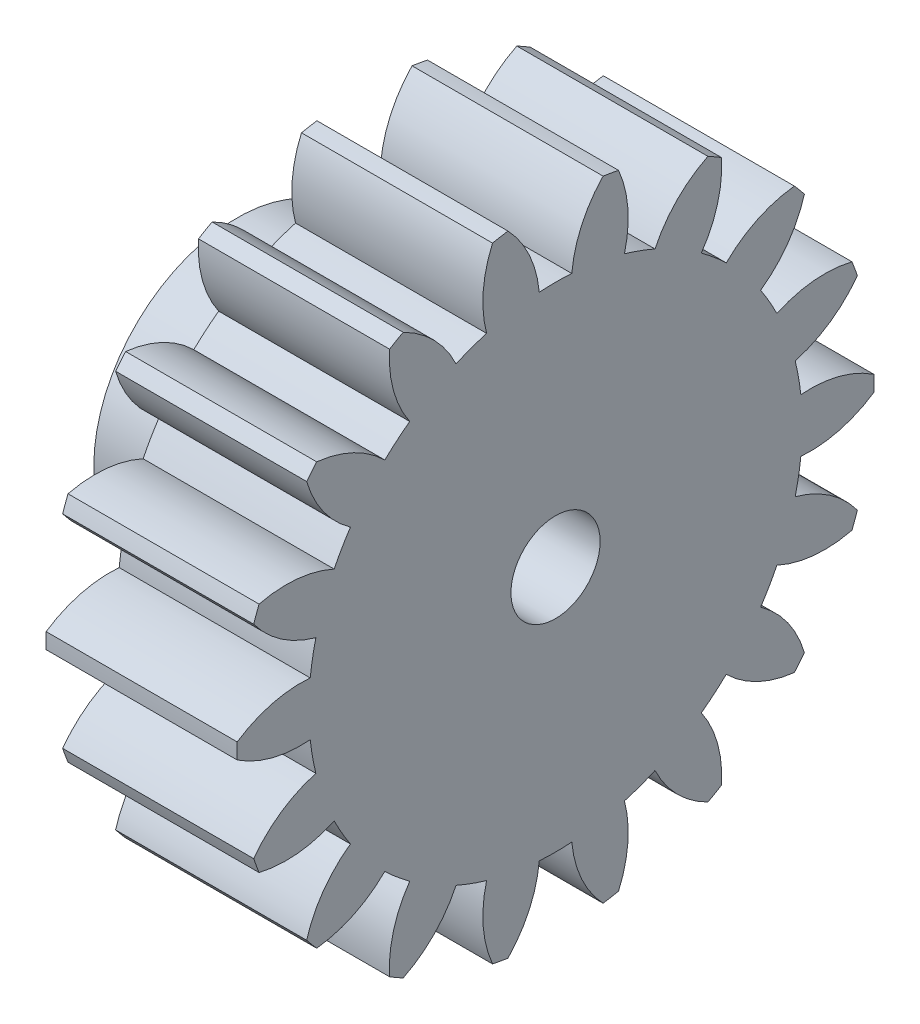
from build123d import *

# Parameters (mm, degrees)
BASPROSKE_W         = 6
BASPROSKE_H         = 10
TOOTHCUT_DEPTH      = 16.362291496
TEETHCUTS_COUNT     = 18
TEETHCUTS_ANGLE     = 340
BORSKE_R            = 0.5
BORE_DEPTH          = 50.0000508
SKETCH3_R           = 2.3
BOSS_EXTRUDE3_DEPTH = 6
SKETCH1_R           = 4.5
BOSS_EXTRUDE4_DEPTH = 4
SKETCH4_R           = 2.5
CUT_EXTRUDE1_DEPTH  = 4
SKETCH5_R           = 1.4
CUT_EXTRUDE2_DEPTH  = 6


with BuildPart() as part:
    # BasProSke → Base-Revolve (revolve)
    with BuildSketch(Plane(origin=(0, 0, 0), x_dir=(1, 0, 0), z_dir=(0, 1, 0)), mode=Mode.PRIVATE) as base_revolve_sk:
        with Locations((3, 5)):
            Rectangle(BASPROSKE_W, BASPROSKE_H)
    revolve(base_revolve_sk.sketch.rotate(Axis((-10, 0, 0), (1, 0, 0)), 180), axis=Axis((-10, 0, 0), (1, 0, 0)))

    # TooCutSke → ToothCut (cut, through all)
    with BuildSketch(Plane(origin=(0, 0, 0), x_dir=(0, 0, -1), z_dir=(1, 0, 0))):
        with BuildLine():
            ThreePointArc((0.510641536, 7.732156635), (0, 7.749), (-0.510641536, 7.732156635))
            ThreePointArc((-0.510641536, 7.732156635), (-0.82619259, 8.907320741), (-1.515208602, 9.910236529))
            ThreePointArc((-1.515208602, 9.910236529), (0, 10.0254), (1.515208602, 9.910236529))
            ThreePointArc((1.515208602, 9.910236529), (0.82619259, 8.907320741), (0.510641536, 7.732156635))
        make_face()
    toothcut = extrude(amount=TOOTHCUT_DEPTH, mode=Mode.SUBTRACT)

    # TeethCuts: ToothCut ×18 about axis
    teethcuts_axis = Axis((-10, 0, 0), (1, 0, 0))
    for i in range(1, TEETHCUTS_COUNT):
        add(toothcut.rotate(teethcuts_axis, i * TEETHCUTS_ANGLE / (TEETHCUTS_COUNT - 1)), mode=Mode.SUBTRACT)

    # BorSke → Bore (cut, symmetric)
    with BuildSketch(Plane(origin=(0, 0, 0), x_dir=(0, 0, -1), z_dir=(1, 0, 0))):
        with Locations(Location((0, 0, 0), (0, 0, 180))):
            Circle(BORSKE_R)
    extrude(amount=BORE_DEPTH, both=True, mode=Mode.SUBTRACT)

    # Sketch3 → Boss-Extrude3 (add)
    with BuildSketch(Plane(origin=(6, 0, 0), x_dir=(0, 0, -1), z_dir=(1, 0, 0))):
        Circle(SKETCH3_R)
    extrude(amount=-BOSS_EXTRUDE3_DEPTH)

    # Sketch1 → Boss-Extrude4 (add)
    with BuildSketch(Plane.ZY):
        with Locations(Location((0, 0, 0), (0, 0, 180))):
            Circle(SKETCH1_R)
    extrude(amount=BOSS_EXTRUDE4_DEPTH)

    # Sketch4 → Cut-Extrude1 (cut)
    with BuildSketch(Plane.ZY.offset(4)):
        Circle(SKETCH4_R)
    extrude(amount=-CUT_EXTRUDE1_DEPTH, mode=Mode.SUBTRACT)

    # Sketch5 → Cut-Extrude2 (cut)
    with BuildSketch(Plane(origin=(6, 0, 0), x_dir=(0, 0, -1), z_dir=(1, 0, 0))):
        Circle(SKETCH5_R)
    extrude(amount=-CUT_EXTRUDE2_DEPTH, mode=Mode.SUBTRACT)


solid = part.part
